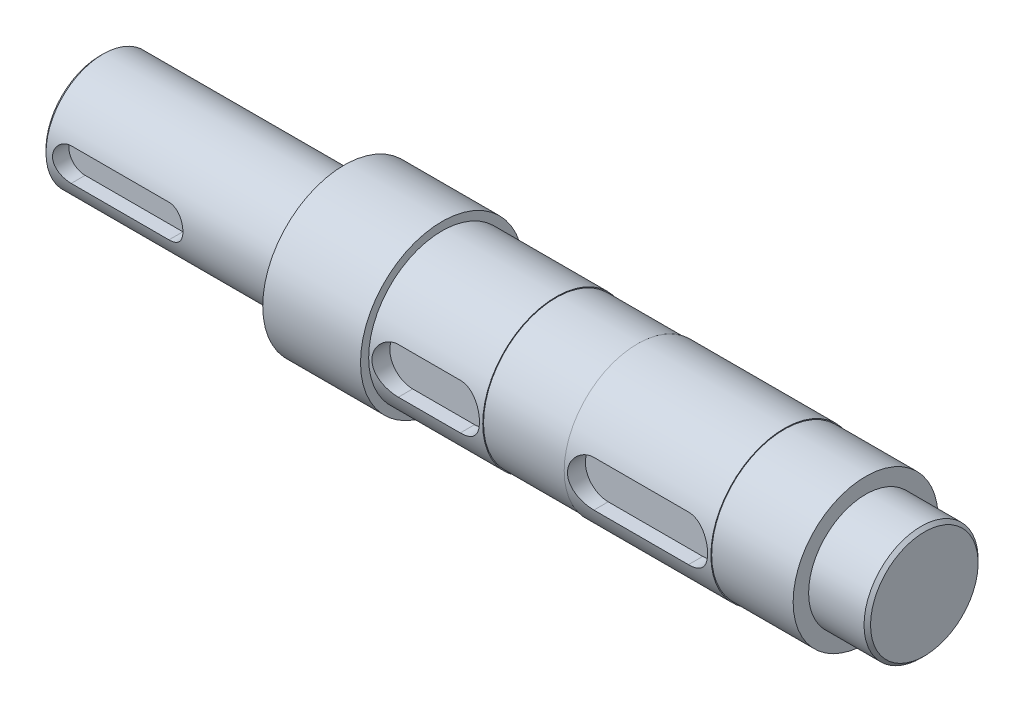
from build123d import *

# Parameters (mm, degrees)
HOLE_WIZARD_M6_1_D     = 5
HOLE_WIZARD_M6_1_DEPTH = 17
HOLE_WIZARD_M6_1_TIP   = 1.502151548
CUT_EXTRUDE_1_DEPTH    = 10
CUT_EXTRUDE_2_DEPTH    = 10
CHAMFER_1_SIZE         = 1


with BuildPart() as part:
    # 草图1 → 旋转1 (revolve)
    with BuildSketch(Plane.XY, mode=Mode.PRIVATE) as revolve_1_sk:
        Polygon((0, 0), (0, 17.5), (75, 17.5), (75, 25), (105, 25), (105, 22.5), (140, 22.5), (140, 22.25), (165, 22.25), (165, 22.5), (210, 22.5), (210, 22.25), (235, 22.25), (235, 17.5), (253, 17.5), (253, 0), align=None)
    revolve(revolve_1_sk.sketch.rotate(Axis((0, 0, 0), (1, 0, 0)), 90), axis=Axis((0, 0, 0), (1, 0, 0)))

    # M6 螺纹孔1
    with Locations(Plane(origin=(0, 0, 0), x_dir=(0, 0, -1), z_dir=(-1, 0, 0))):
        with Locations((0, 0)):
            Hole(HOLE_WIZARD_M6_1_D / 2, depth=HOLE_WIZARD_M6_1_DEPTH)
            with Locations((0, 0, -(HOLE_WIZARD_M6_1_DEPTH + HOLE_WIZARD_M6_1_TIP / 2))):  # 118° drill point
                Cone(0, HOLE_WIZARD_M6_1_D / 2, HOLE_WIZARD_M6_1_TIP, mode=Mode.SUBTRACT)

    # 草图4 → 切除-拉伸1 (cut)
    with BuildSketch(Plane.XY.offset(17)):
        with BuildLine():
            Line((113, 7), (132, 7))
            ThreePointArc((132, 7), (139, 0), (132, -7))
            Line((132, -7), (113, -7))
            ThreePointArc((113, -7), (106, 0), (113, 7))
        make_face()
        with BuildLine():
            Line((173, 7), (202, 7))
            ThreePointArc((202, 7), (209, 0), (202, -7))
            Line((202, -7), (173, -7))
            ThreePointArc((173, -7), (166, 0), (173, 7))
        make_face()
    extrude(amount=CUT_EXTRUDE_1_DEPTH, mode=Mode.SUBTRACT)

    # 草图5 → 切除-拉伸2 (cut)
    with BuildSketch(Plane.XY.offset(12.5)):
        with BuildLine():
            Line((8, 5), (38, 5))
            ThreePointArc((38, 5), (43, 0), (38, -5))
            Line((38, -5), (8, -5))
            ThreePointArc((8, -5), (3, 0), (8, 5))
        make_face()
    extrude(amount=CUT_EXTRUDE_2_DEPTH, mode=Mode.SUBTRACT)

    # 倒角1
    chamfer_1_edges = [part.edges().sort_by_distance(p)[0] for p in [
        (253, 0, -17.5),
        (0, 0, -17.5),
    ]]
    chamfer(chamfer_1_edges, length=CHAMFER_1_SIZE)


solid = part.part
